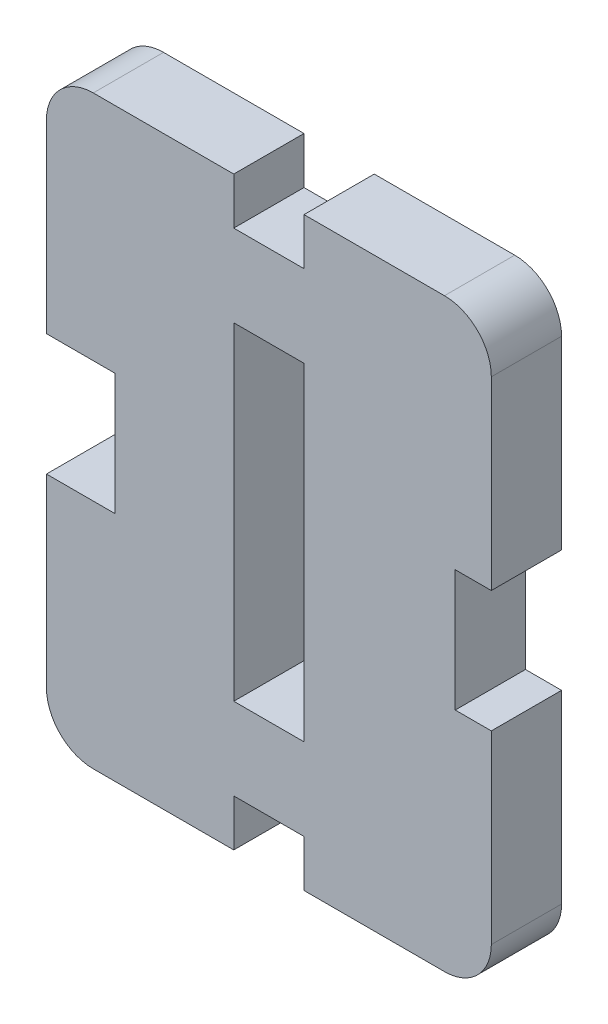
from build123d import *

# Parameters (mm, degrees)
SKETCH1_W          = 3
SKETCH1_H          = 14
BASE_EXTRUDE_DEPTH = 3


with BuildPart() as part:
    # Sketch1 → Base-Extrude (new body)
    with BuildSketch(Plane.XY):
        with BuildLine():
            Line((-1033.116910611, 53.997744838), (-1033.116910611, 46.093073912))
            Line((-1033.116910611, 46.093073912), (-1034.65769353, 46.093073912))
            Line((-1034.65769353, 46.093073912), (-1034.65769353, 40.902415763))
            Line((-1034.65769353, 40.902415763), (-1033.116910611, 40.902415763))
            Line((-1033.116910611, 40.902415763), (-1033.116910611, 32.997744838))
            ThreePointArc((-1033.116910611, 32.997744838), (-1033.702697049, 31.583531275), (-1035.116910611, 30.997744838))
            Line((-1035.116910611, 30.997744838), (-1041.116910611, 30.997744838))
            Line((-1041.116910611, 30.997744838), (-1041.116910611, 32.997744838))
            Line((-1041.116910611, 32.997744838), (-1042.616910611, 32.997744838))
            Line((-1042.616910611, 32.997744838), (-1044.116910611, 32.997744838))
            Line((-1044.116910611, 32.997744838), (-1044.116910611, 30.997744838))
            Line((-1044.116910611, 30.997744838), (-1050.116910611, 30.997744838))
            ThreePointArc((-1050.116910611, 30.997744838), (-1051.531124173, 31.583531275), (-1052.116910611, 32.997744838))
            Line((-1052.116910611, 32.997744838), (-1052.116910611, 40.902415763))
            Line((-1052.116910611, 40.902415763), (-1049.190418334, 40.902415763))
            Line((-1049.190418334, 40.902415763), (-1049.190418334, 46.093073912))
            Line((-1049.190418334, 46.093073912), (-1052.116910611, 46.093073912))
            Line((-1052.116910611, 46.093073912), (-1052.116910611, 53.997744838))
            ThreePointArc((-1052.116910611, 53.997744838), (-1051.531124173, 55.4119584), (-1050.116910611, 55.997744838))
            Line((-1050.116910611, 55.997744838), (-1044.116910611, 55.997744838))
            Line((-1044.116910611, 55.997744838), (-1044.116910611, 53.997744838))
            Line((-1044.116910611, 53.997744838), (-1042.616910611, 53.997744838))
            Line((-1042.616910611, 53.997744838), (-1041.116910611, 53.997744838))
            Line((-1041.116910611, 53.997744838), (-1041.116910611, 55.997744838))
            Line((-1041.116910611, 55.997744838), (-1035.116910611, 55.997744838))
            ThreePointArc((-1035.116910611, 55.997744838), (-1033.702697049, 55.4119584), (-1033.116910611, 53.997744838))
        make_face()
        with Locations((-1042.616910611, 43.497744838)):
            Rectangle(SKETCH1_W, SKETCH1_H, mode=Mode.SUBTRACT)
    extrude(amount=BASE_EXTRUDE_DEPTH)


solid = part.part
